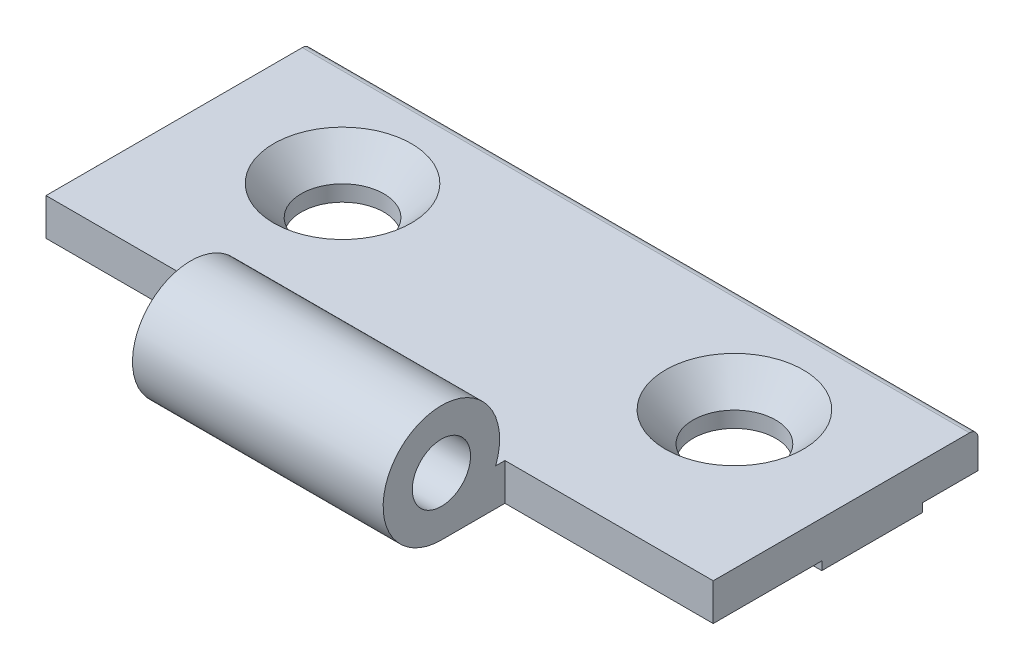
from build123d import *

# Parameters (mm, degrees)
BOSS_EXTRUDE1_DEPTH        = 23.666666667
SKETCH2_W                  = 25
SKETCH2_H                  = 3.5
BOSS_EXTRUDE2_DEPTH        = 19.666666667
SKETCH3_W                  = 25
SKETCH3_H                  = 3.5
BOSS_EXTRUDE3_DEPTH        = 19.666666667
SKETCH4_W                  = 63
SKETCH4_H                  = 14.75
BOSS_EXTRUDE4_DEPTH        = 0.8
SKETCH5_W                  = 5.25
SKETCH5_H                  = 0.8
CUT_EXTRUDE1_DEPTH         = 72.070387645
F_10_CLEARANCE_HOLE1_D     = 5.5
F_10_CLEARANCE_HOLE1_DEPTH = 43.333333333
HOLE1_AT_2_COUNT           = 2
HOLE1_AT_2_PITCH           = 37
FILLET1_R                  = 0.8
SCALE1_SCALE               = 0.3333


with BuildPart() as part:
    # Sketch1 → Boss-Extrude1 (new body)
    with BuildSketch(Plane(origin=(11.833333333, 0, 0), x_dir=(0, 0, -1), z_dir=(1, 0, 0))):
        with BuildLine():
            Line((31, 3.5), (5.123475383, 3.5))
            ThreePointArc((5.123475383, 3.5), (-3.102418411, 10.041475531), (0, 0))
            Line((0, 0), (31, 0))
            Line((31, 0), (31, 3.5))
        make_face()
    extrude(amount=-BOSS_EXTRUDE1_DEPTH)

    # Sketch2 → Boss-Extrude2 (add)
    with BuildSketch(Plane.ZY.offset(11.833333333)):
        with Locations((-18.5, 1.75)):
            Rectangle(SKETCH2_W, SKETCH2_H)
    extrude(amount=BOSS_EXTRUDE2_DEPTH)

    # Sketch3 → Boss-Extrude3 (add)
    with BuildSketch(Plane(origin=(11.833333333, 0, 0), x_dir=(0, 0, -1), z_dir=(1, 0, 0))):
        with Locations((18.5, 1.75)):
            Rectangle(SKETCH3_W, SKETCH3_H)
    extrude(amount=BOSS_EXTRUDE3_DEPTH)

    # Sketch4 → Boss-Extrude4 (add)
    with BuildSketch(Plane.XZ):
        with Locations((0, -23.625)):
            Rectangle(SKETCH4_W, SKETCH4_H)
    extrude(amount=BOSS_EXTRUDE4_DEPTH)

    # Sketch5 → Cut-Extrude1 (cut, through all)
    with BuildSketch(Plane(origin=(31.5, 0, 0), x_dir=(0, 0, -1), z_dir=(1, 0, 0))):
        with Locations((28.375, -0.4)):
            Rectangle(SKETCH5_W, SKETCH5_H)
    extrude(amount=-CUT_EXTRUDE1_DEPTH, mode=Mode.SUBTRACT)

    # #10 Clearance Hole1
    with Locations(Plane.ZY.offset(11.833333333)):
        with Locations((0, 5.5)):
            Hole(F_10_CLEARANCE_HOLE1_D / 2, depth=F_10_CLEARANCE_HOLE1_DEPTH)

    # Sketch8 → Hole1 (revolve, cut)
    with BuildSketch(Plane(origin=(-18.5, 3.5, -21), x_dir=(0, 0, 1), z_dir=(1, 0, 0))):
        Polygon((0, 0), (0, 4.3), (3.9, 4.3), (3.9, 2.8), (6.5, 0), align=None)
    hole1 = revolve(axis=Axis((-18.5, 9.945314094, -21), (0, -1, 0)), mode=Mode.SUBTRACT)

    # Hole1 at 2: Hole1 ×2
    with Locations(*[(i * HOLE1_AT_2_PITCH, 0, 0) for i in range(1, HOLE1_AT_2_COUNT)]):
        add(hole1, mode=Mode.SUBTRACT)

    # Fillet1
    fillet1_edges = [part.edges().sort_by_distance(p)[0] for p in [
        (0, 3.5, -31),
    ]]
    fillet(fillet1_edges, radius=FILLET1_R)


with BuildPart() as part_1:
    # Scale1: scaled about (0, 2.464609402, -13.752110163)
    add(part.part.scale(SCALE1_SCALE).moved(Location((0, 1.643155088, -9.168531846))))


solid = part_1.part
